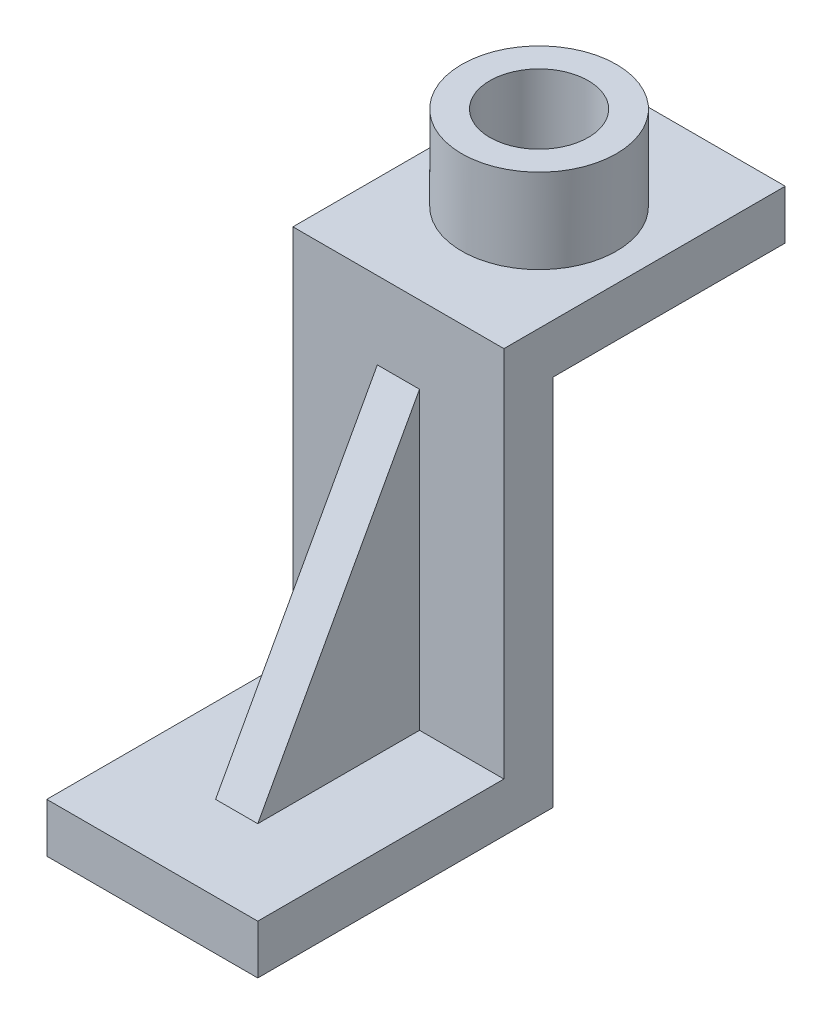
from build123d import *

# Parameters (mm, degrees)
SKETCH1_W           = 30
SKETCH1_H           = 60
BOSS_EXTRUDE1_DEPTH = 7
SKETCH2_W           = 30
SKETCH2_H           = 7
BOSS_EXTRUDE2_DEPTH = 35
BOSS_EXTRUDE3_DEPTH = 3
SKETCH4_W           = 30
SKETCH4_H           = 7
BOSS_EXTRUDE4_DEPTH = 33
SKETCH5_R           = 11
SKETCH5_R_2         = 7
BOSS_EXTRUDE5_DEPTH = 12
CUT_EXTRUDE1_START  = -12
SKETCH6_R           = 7
CUT_EXTRUDE1_DEPTH  = 12


with BuildPart() as part:
    # Sketch1 → Boss-Extrude1 (new body)
    with BuildSketch(Plane.XY):
        Rectangle(SKETCH1_W, SKETCH1_H)
    extrude(amount=BOSS_EXTRUDE1_DEPTH)

    # Sketch2 → Boss-Extrude2 (add)
    with BuildSketch(Plane.XY.offset(7)):
        with Locations((0, -26.5)):
            Rectangle(SKETCH2_W, SKETCH2_H)
    extrude(amount=BOSS_EXTRUDE2_DEPTH)

    # Sketch3 → Boss-Extrude3 (add, symmetric)
    with BuildSketch(Plane(origin=(0, 0, 0), x_dir=(0, 0, -1), z_dir=(1, 0, 0))):
        Polygon((-7, -23), (-7, 19), (-30, -23), align=None)
    extrude(amount=BOSS_EXTRUDE3_DEPTH, both=True)

    # Sketch4 → Boss-Extrude4 (add)
    with BuildSketch(Plane(origin=(0, 0, 0), x_dir=(-1, 0, 0), z_dir=(0, 0, -1))):
        with Locations((0, 26.5)):
            Rectangle(SKETCH4_W, SKETCH4_H)
    extrude(amount=BOSS_EXTRUDE4_DEPTH)

    # Sketch5 → Boss-Extrude5 (add)
    with BuildSketch(Plane(origin=(0, 30, 0), x_dir=(1, 0, 0), z_dir=(0, 1, 0))):
        with Locations(Location((0, 13, 0), (0, 0, 90))):
            Circle(SKETCH5_R)
        with Locations(Location((0, 13, 0), (0, 0, 270))):
            Circle(SKETCH5_R_2, mode=Mode.SUBTRACT)
    extrude(amount=BOSS_EXTRUDE5_DEPTH)

    # Sketch6 → Cut-Extrude1 (cut)
    with BuildSketch(Plane(origin=(0, 30, 0), x_dir=(1, 0, 0), z_dir=(0, 1, 0)).offset(CUT_EXTRUDE1_START)):
        with Locations(Location((0, 13, 0), (0, 0, 270))):
            Circle(SKETCH6_R)
    extrude(amount=CUT_EXTRUDE1_DEPTH, mode=Mode.SUBTRACT)


solid = part.part
